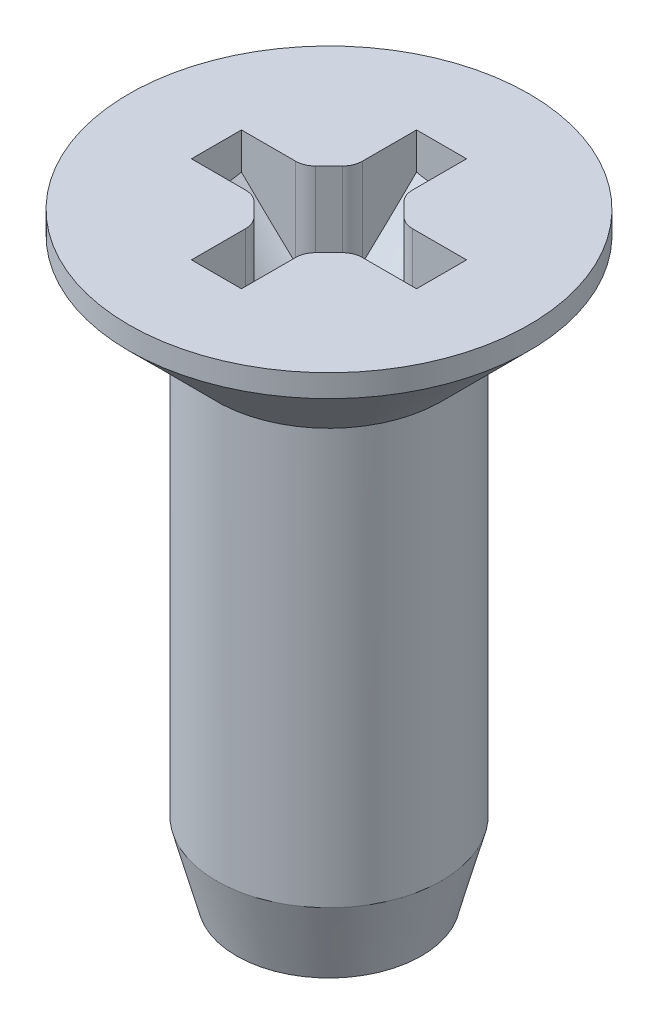
from build123d import *

# Parameters (mm, degrees)
CUT_EXTRUDE2_REACH = 15.266
CHAMFER1_SIZE      = 0.5
FILLET1_R          = 0.4


with BuildPart() as part:
    # Sketch1 → Revolve1 (revolve)
    with BuildSketch(Plane.XY, mode=Mode.PRIVATE) as revolve1_sk:
        Polygon((0, 0), (0, -12), (2.25, -12), (2.25, -2.2), (4, -0.45), (4, 0), align=None)
    revolve(revolve1_sk.sketch.rotate(Axis((0, 0, 0), (0, 1, 0)), 90), axis=Axis((0, 0, 0), (0, 1, 0)))

    # Sketch4 → Cut-Revolve1 (revolve, cut)
    with BuildSketch(Plane(origin=(0, 0, 0), x_dir=(0, 0, -1), z_dir=(1, 0, 0))):
        Polygon((1.85, -12), (2.25, -10.5), (2.25, -12), align=None)
    revolve(axis=Axis((0, 0, 0), (0, -1, 0)), mode=Mode.SUBTRACT)

    # Cut-Extrude2: up to this cone (the profile starts inside it)
    cut_extrude2_end = Plane(origin=(0, 0, 0), z_dir=(0, 1, 0)).offset(-3.035785438) * Cone(1e-06, 21.837572875, 21.837571875, align=(Align.CENTER, Align.CENTER, Align.MIN), mode=Mode.PRIVATE)
    # Sketch6 → Cut-Extrude2 (cut, up to the surface)
    with BuildSketch(Plane(origin=(0, 0, 0), x_dir=(1, 0, 0), z_dir=(0, 1, 0)), mode=Mode.PRIVATE) as cut_extrude2_sk1:
        Polygon((-0.5, 2.25), (0.5, 2.25), (0.5, 0.5), (2.25, 0.5), (2.25, -0.5), (0.5, -0.5), (0.5, -2.25), (-0.5, -2.25), (-0.5, -0.5), (-2.25, -0.5), (-2.25, 0.5), (-0.5, 0.5), align=None)
    cut_extrude2_tool1 = extrude(cut_extrude2_sk1.sketch, amount=-CUT_EXTRUDE2_REACH, mode=Mode.PRIVATE) & cut_extrude2_end
    add(cut_extrude2_tool1.solids().sort_by_distance((0, 0, 0))[0], mode=Mode.SUBTRACT)

    # Chamfer1
    chamfer1_edges = [part.edges().sort_by_distance(p)[0] for p in [
        (0.5, -1.164339828, 0.5),
        (-0.5, -1.164339828, 0.5),
        (0.5, -1.164339828, -0.5),
        (-0.5, -1.164339828, -0.5),
    ]]
    chamfer(chamfer1_edges, length=CHAMFER1_SIZE)

    # Fillet1
    fillet1_edges = [part.edges().sort_by_distance(p)[0] for p in [
        (-1, -0.958876224, 0.5),
        (-0.5, -0.958876224, 1),
        (0.5, -0.958876224, 1),
        (1, -0.958876224, 0.5),
        (1, -0.958876224, -0.5),
        (0.5, -0.958876224, -1),
        (-0.5, -0.958876224, -1),
        (-1, -0.958876224, -0.5),
    ]]
    fillet(fillet1_edges, radius=FILLET1_R)


solid = part.part
